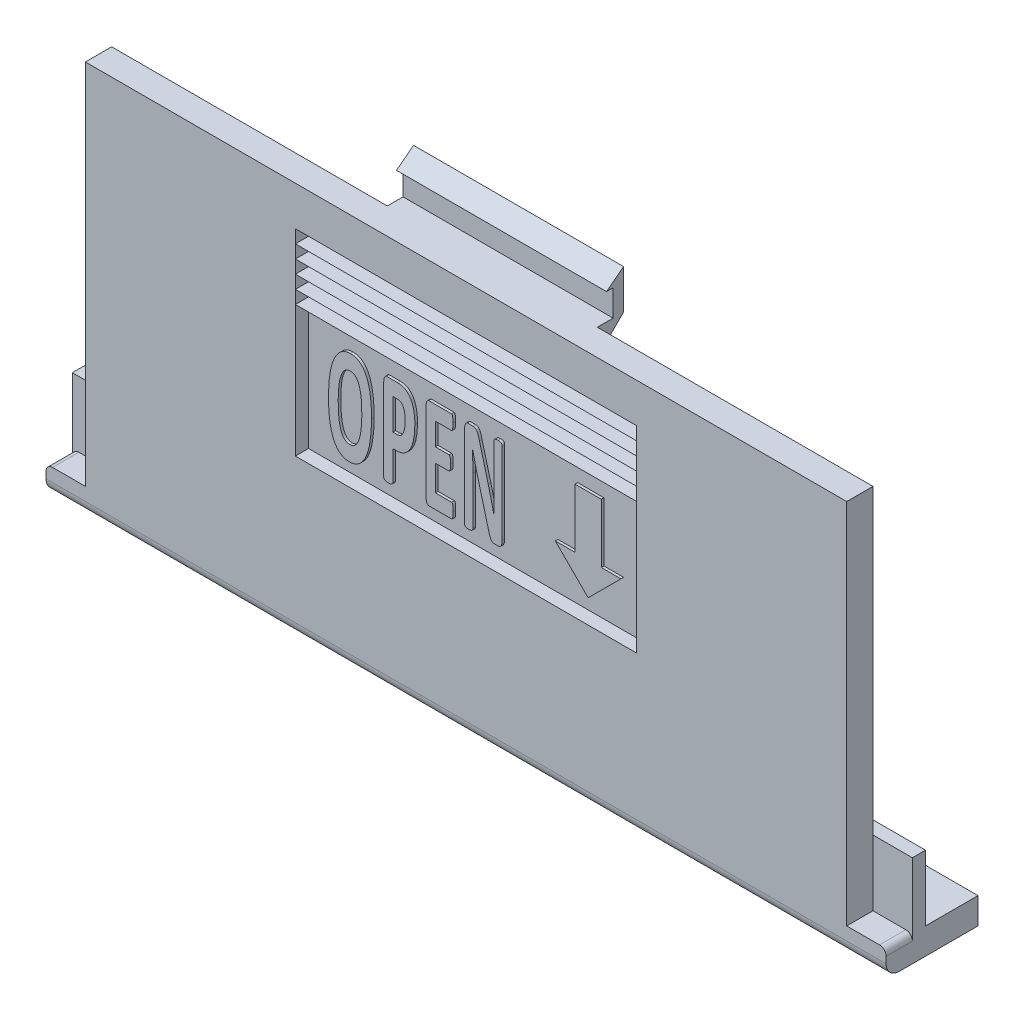
from build123d import *

# Parameters (mm, degrees)
SCHIZZO1_W                                         = 64
SCHIZZO1_H                                         = 30
ESTRUSIONE_FACCIA_SPORTELLO_DEPTH                  = 1
TAGLIO_ESTRUSIONE3_DEPTH                           = 2
TAGLIO_ESTRUSIONE3_DEPTH_BACK                      = 2
SCHIZZO3_W                                         = 3
SCHIZZO3_H                                         = 28
TAGLIO_ESTRUSIONE4_DEPTH                           = 2
TAGLIO_ESTRUSIONE4_DEPTH_BACK                      = 2
SCHIZZO4_W                                         = 3
SCHIZZO4_H                                         = 28
ESTRUSIONE_CHIUSURA_INFERIORE_SPORTELLO_DEPTH      = 32
ESTRUSIONE_CHIUSURA_INFERIORE_SPORTELLO_DEPTH_BACK = 32
SCHIZZO5_W                                         = 5
SCHIZZO5_H                                         = 2
SCHIZZO7_W                                         = 1
SCHIZZO7_H                                         = 5
ESTRUSIONE_ALETTA_SPORTELLO_INFERIORE_DEPTH        = 4
SCHIZZO24_W                                        = 1
SCHIZZO24_H                                        = 5
ESTRUSIONE_ESTRUSIONE12_DEPTH                      = 4
ESTRUSIONE_SUPPORTO_CHIUSURA_DEPTH                 = 8
ESTRUSIONE_SUPPORTO_CHIUSURA_DEPTH_BACK            = 8
ESTRUSIONE_GANCIO_CHIUSURA_DEPTH                   = 8
ESTRUSIONE_GANCIO_CHIUSURA_DEPTH_BACK              = 8
SCHIZZO10_W                                        = 26
SCHIZZO10_H                                        = 15
TAGLIO_SCAVO_SPORTELLO_DEPTH                       = 1
ESTRUSIONE_ESTRUSIONE7_DEPTH                       = 26
ESTRUSIONE_ESTRUSIONE8_DEPTH                       = 26
RIPETIZIONE_A_L3_COUNT                             = 5
RIPETIZIONE_A_L3_PITCH                             = 1
ESTRUSIONE_OPEN_DEPTH                              = 0.2
ESTRUSIONE_ESTRUSIONE11_DEPTH                      = 0.2
RACCORDO6_R                                        = 0.5
RACCORDO7_R                                        = 0.5
RACCORDO10_R                                       = 0.5
RACCORDO11_R                                       = 1


with BuildPart() as part:
    # Schizzo1 → Estrusione-Faccia sportello (new, symmetric)
    with BuildSketch(Plane.XY):
        Rectangle(SCHIZZO1_W, SCHIZZO1_H)
    extrude(amount=ESTRUSIONE_FACCIA_SPORTELLO_DEPTH, both=True)

    # Schizzo3 → Taglio-Estrusione3 (cut, two sides: drawn at the far end of the back side and taken through both)
    with BuildSketch(Plane.XY.offset(-TAGLIO_ESTRUSIONE3_DEPTH_BACK)):
        with Locations((-30.5, 1)):
            Rectangle(SCHIZZO3_W, SCHIZZO3_H)
    extrude(amount=TAGLIO_ESTRUSIONE3_DEPTH + TAGLIO_ESTRUSIONE3_DEPTH_BACK, mode=Mode.SUBTRACT)

    # Schizzo4 → Taglio-Estrusione4 (cut, two sides: drawn at the far end of the back side and taken through both)
    with BuildSketch(Plane.XY.offset(-TAGLIO_ESTRUSIONE4_DEPTH_BACK)):
        with Locations((30.5, 1)):
            Rectangle(SCHIZZO4_W, SCHIZZO4_H)
    extrude(amount=TAGLIO_ESTRUSIONE4_DEPTH + TAGLIO_ESTRUSIONE4_DEPTH_BACK, mode=Mode.SUBTRACT)

    # Schizzo5 → Estrusione-Chiusura inferiore sportello (add, two sides: drawn at the far end of the back side and taken through both)
    with BuildSketch(Plane(origin=(0, 0, 0), x_dir=(0, 0, -1), z_dir=(1, 0, 0)).offset(-ESTRUSIONE_CHIUSURA_INFERIORE_SPORTELLO_DEPTH_BACK)):
        with Locations((3.5, -14)):
            Rectangle(SCHIZZO5_W, SCHIZZO5_H)
    extrude(amount=ESTRUSIONE_CHIUSURA_INFERIORE_SPORTELLO_DEPTH + ESTRUSIONE_CHIUSURA_INFERIORE_SPORTELLO_DEPTH_BACK)

    # Schizzo7 → Estrusione-Aletta sportello inferiore (add)
    with BuildSketch(Plane(origin=(28, 0, 0), x_dir=(0, 0, -1), z_dir=(1, 0, 0))):
        with Locations((1.5, -10.5)):
            Rectangle(SCHIZZO7_W, SCHIZZO7_H)
    extrude(amount=ESTRUSIONE_ALETTA_SPORTELLO_INFERIORE_DEPTH)

    # Schizzo24 → Estrusione-Estrusione12 (add)
    with BuildSketch(Plane(origin=(-28, 0, 0), x_dir=(0, 0, -1), z_dir=(1, 0, 0))):
        with Locations((1.5, -10.5)):
            Rectangle(SCHIZZO24_W, SCHIZZO24_H)
    extrude(amount=-ESTRUSIONE_ESTRUSIONE12_DEPTH)

    # Schizzo8 → Estrusione-Supporto chiusura (add, two sides: drawn at the far end of the back side and taken through both)
    with BuildSketch(Plane(origin=(0, 0, 0), x_dir=(0, 0, -1), z_dir=(1, 0, 0)).offset(-ESTRUSIONE_SUPPORTO_CHIUSURA_DEPTH_BACK)):
        Polygon((1, 15), (1, 13), (3, 15), align=None)
    extrude(amount=ESTRUSIONE_SUPPORTO_CHIUSURA_DEPTH + ESTRUSIONE_SUPPORTO_CHIUSURA_DEPTH_BACK)

    # Schizzo9 → Estrusione-Gancio chiusura (add, two sides: drawn at the far end of the back side and taken through both)
    with BuildSketch(Plane(origin=(0, 0, 0), x_dir=(0, 0, -1), z_dir=(1, 0, 0)).offset(-ESTRUSIONE_GANCIO_CHIUSURA_DEPTH_BACK)):
        Polygon((2.2, 15), (3, 15), (3, 18), (1.7, 17), (2.2, 17), align=None)
    extrude(amount=ESTRUSIONE_GANCIO_CHIUSURA_DEPTH + ESTRUSIONE_GANCIO_CHIUSURA_DEPTH_BACK)

    # Schizzo10 → Taglio-Scavo sportello (cut)
    with BuildSketch(Plane.XY):
        with Locations((0, 4.5)):
            Rectangle(SCHIZZO10_W, SCHIZZO10_H)
    extrude(amount=TAGLIO_SCAVO_SPORTELLO_DEPTH, mode=Mode.SUBTRACT)

    # Schizzo13 → Estrusione-Estrusione7 (add)
    with BuildSketch(Plane(origin=(-13, 0, 0), x_dir=(0, 0, -1), z_dir=(1, 0, 0))):
        Polygon((-1, 12), (0, 12), (0, 11), align=None)
    extrude(amount=ESTRUSIONE_ESTRUSIONE7_DEPTH)

    # Schizzo14 → Estrusione-Estrusione8 (add)
    with BuildSketch(Plane(origin=(-13, 0, 0), x_dir=(0, 0, -1), z_dir=(1, 0, 0))):
        Polygon((0, 11), (-1, 11), (0, 10), align=None)
    estrusione_estrusione8 = extrude(amount=ESTRUSIONE_ESTRUSIONE8_DEPTH)

    # Ripetizione a L3: Estrusione-Estrusione8 ×5
    with Locations(*[(0, -i * RIPETIZIONE_A_L3_PITCH, 0) for i in range(1, RIPETIZIONE_A_L3_COUNT)]):
        add(estrusione_estrusione8)

    # Schizzo19 → Estrusione-Open (add)
    # profile 1 of 4: a face of its own
    with BuildSketch(Plane.XY):
        with BuildLine():
            add(Edge.make_bspline(
                [(-7.999001815, 1.547640653), (-7.999992613, 1.407864648), (-8.001922827, 1.135561377), (-8.02347731, 0.738327912), (-8.055698522, 0.363120068), (-8.102930933, 0.011211096), (-8.163693675, -0.316075285), (-8.232594657, -0.618932464), (-8.32159197, -0.894511465), (-8.418635135, -1.145794204), (-8.52813523, -1.37133144), (-8.65579916, -1.566108616), (-8.7906941, -1.737394737), (-8.943518747, -1.876132425), (-9.106352456, -1.988706108), (-9.284007177, -2.067346582), (-9.47393227, -2.114735066), (-9.604749937, -2.120790371), (-9.671188748, -2.123865699)],
                knots=[0, 0, 0, 0, 1.514222927, 2.949918723, 4.308734705, 5.593484874, 6.794834329, 7.914635642, 8.955730053, 9.929132873, 10.831941001, 11.665496277, 12.448323255, 13.187097232, 13.893345269, 14.583958704, 15.280830313, 16, 16, 16, 16], degree=3))
            add(Edge.make_bspline(
                [(-9.671188748, -2.123865699), (-9.736497229, -2.121621839), (-9.864678764, -2.117217797), (-10.050362157, -2.07678146), (-10.222541608, -2.008995036), (-10.382559825, -1.915861269), (-10.528088025, -1.793558917), (-10.658554689, -1.642387177), (-10.780476931, -1.467276556), (-10.88587459, -1.261540644), (-10.979716847, -1.028158346), (-11.059161104, -0.765229107), (-11.129285373, -0.473727146), (-11.185392261, -0.152250475), (-11.230012396, 0.199041335), (-11.25832403, 0.580698439), (-11.278328892, 0.992679032), (-11.280379769, 1.277649739), (-11.281442831, 1.425362976)],
                knots=[0, 0, 0, 0, 0.725663488, 1.424266175, 2.100994291, 2.776492084, 3.47449916, 4.204448662, 4.991582669, 5.842144597, 6.769215763, 7.785958339, 8.894031491, 10.101997046, 11.41348336, 12.83084749, 14.357284574, 16, 16, 16, 16], degree=3))
            add(Edge.make_bspline(
                [(-11.281442831, 1.425362976), (-11.280435752, 1.561962101), (-11.278471106, 1.82844432), (-11.257054606, 2.21775869), (-11.224277134, 2.585952409), (-11.179125694, 2.932741282), (-11.118932836, 3.256032745), (-11.046840262, 3.556093479), (-10.959526838, 3.830145005), (-10.861884469, 4.080037934), (-10.74991521, 4.302842819), (-10.623876783, 4.497950066), (-10.4870945, 4.667067404), (-10.33695757, 4.808171059), (-10.174187534, 4.922717022), (-9.994937408, 4.999747738), (-9.804702542, 5.050354333), (-9.673108034, 5.055921266), (-9.606079855, 5.058756806)],
                knots=[0, 0, 0, 0, 1.492209114, 2.911052286, 4.258207687, 5.530021065, 6.730058531, 7.849346097, 8.899158892, 9.869955582, 10.777748849, 11.618284525, 12.403184643, 13.147830977, 13.86324965, 14.564933045, 15.269043018, 16, 16, 16, 16], degree=3))
            add(Edge.make_bspline(
                [(-9.606079855, 5.058756806), (-9.542322301, 5.056594598), (-9.417210789, 5.052351695), (-9.235898557, 5.010594232), (-9.065250997, 4.946121407), (-8.908273092, 4.851470334), (-8.760796992, 4.733063762), (-8.629920165, 4.58236771), (-8.507826506, 4.406969427), (-8.403149333, 4.201238253), (-8.306797166, 3.969614529), (-8.226373126, 3.708561843), (-8.153856368, 3.420009369), (-8.098253206, 3.101941563), (-8.054664838, 2.755278014), (-8.020794566, 2.379274682), (-8.00252443, 1.973414949), (-8.000201929, 1.69269705), (-7.999001815, 1.547640653)],
                knots=[0, 0, 0, 0, 0.715505355, 1.404036879, 2.080196936, 2.757690514, 3.455489848, 4.197083904, 4.992517363, 5.852047519, 6.785638831, 7.809201734, 8.918813181, 10.127803088, 11.435413021, 12.845004552, 14.369707549, 16, 16, 16, 16], degree=3))
        make_face()
        with BuildLine():
            add(Edge.make_bspline(
                [(-8.739019964, 1.47300363), (-8.739715991, 1.561939183), (-8.741079318, 1.736139689), (-8.749177903, 1.990804749), (-8.761379236, 2.233368915), (-8.780101375, 2.462740465), (-8.805566146, 2.678284835), (-8.835560604, 2.878624956), (-8.878183814, 3.062114647), (-8.924364216, 3.230298947), (-8.979511911, 3.381435077), (-9.04283932, 3.51506699), (-9.115727702, 3.629936206), (-9.197103926, 3.727189193), (-9.288695936, 3.805344754), (-9.391891551, 3.862645811), (-9.507869481, 3.894738114), (-9.588419889, 3.89893018), (-9.629900181, 3.901088929)],
                knots=[0, 0, 0, 0, 1.513210283, 2.963966486, 4.334859306, 5.64527595, 6.878616546, 8.02765105, 9.0895477, 10.081742653, 10.993587949, 11.823414824, 12.592936149, 13.302171044, 13.973326409, 14.630312022, 15.29466455, 16, 16, 16, 16], degree=3))
            add(Edge.make_bspline(
                [(-9.629900181, 3.901088929), (-9.672050448, 3.898797281), (-9.75381806, 3.894351697), (-9.870405287, 3.854925504), (-9.977388869, 3.794810512), (-10.069543308, 3.705632097), (-10.151212048, 3.598377668), (-10.226014409, 3.475271445), (-10.292783496, 3.335876648), (-10.350982388, 3.180675099), (-10.399735025, 3.009993708), (-10.440232635, 2.82524384), (-10.475906742, 2.627309181), (-10.508492002, 2.340767163), (-10.534966407, 1.962070464), (-10.539234389, 1.653560654), (-10.541424682, 1.495235935)],
                knots=[0, 0, 0, 0, 0.631705943, 1.22545101, 1.831330726, 2.461783034, 3.136509036, 3.854189724, 4.622759054, 5.456123766, 6.342377968, 7.288123355, 8.297856721, 9.363579254, 11.62062667, 14, 14, 14, 14], degree=3))
            add(Edge.make_bspline(
                [(-10.541424682, 1.495235935), (-10.540731288, 1.403124465), (-10.539376123, 1.223102489), (-10.531290135, 0.960498546), (-10.519104999, 0.711580853), (-10.500458386, 0.477974756), (-10.475075033, 0.259741332), (-10.444086978, 0.057623634), (-10.404504155, -0.128522609), (-10.357828672, -0.298120385), (-10.302446627, -0.449664338), (-10.239654027, -0.583131159), (-10.166125254, -0.696537896), (-10.08530411, -0.792962328), (-9.991689427, -0.867117503), (-9.887364705, -0.921239834), (-9.771524822, -0.953459992), (-9.690446074, -0.957684149), (-9.648956443, -0.959845735)],
                knots=[0, 0, 0, 0, 1.549283116, 3.027907476, 4.418653304, 5.740671561, 6.968719117, 8.113378157, 9.178583556, 10.167976361, 11.069370615, 11.889686496, 12.642900457, 13.337246653, 13.996334239, 14.637436389, 15.302748696, 16, 16, 16, 16], degree=3))
            add(Edge.make_bspline(
                [(-9.648956443, -0.959845735), (-9.607435191, -0.957237113), (-9.526046492, -0.952123772), (-9.408782872, -0.916579481), (-9.303411498, -0.85437442), (-9.210898988, -0.767823769), (-9.128326854, -0.661413552), (-9.054665909, -0.537038183), (-8.987310558, -0.396533921), (-8.931109756, -0.2386141), (-8.883035107, -0.065818024), (-8.839162914, 0.120351897), (-8.806707434, 0.321030209), (-8.773300074, 0.611574333), (-8.744987978, 0.99712443), (-8.741045409, 1.311498123), (-8.739019964, 1.47300363)],
                knots=[0, 0, 0, 0, 0.617943297, 1.211273719, 1.804656479, 2.423854892, 3.08604707, 3.803738118, 4.572206993, 5.402410358, 6.29550612, 7.241817814, 8.24852195, 9.319904157, 11.595659979, 14, 14, 14, 14], degree=3))
        make_face(mode=Mode.SUBTRACT)
    # profile 2 of 4: a face of its own
    with BuildSketch(Plane.XY):
        with BuildLine():
            add(Edge.make_bspline(
                [(-4.698774955, 2.829174229), (-4.700285103, 2.734412606), (-4.703214751, 2.550577519), (-4.717483429, 2.282675488), (-4.748900247, 2.032258885), (-4.787256682, 1.798136432), (-4.8385343, 1.581948118), (-4.897606687, 1.382839089), (-4.969727834, 1.201804533), (-5.051475517, 1.038243558), (-5.14416084, 0.892499389), (-5.245525547, 0.76435089), (-5.358091691, 0.654869827), (-5.480300812, 0.563431327), (-5.61440064, 0.49272634), (-5.759116024, 0.44122562), (-5.915510757, 0.410741935), (-6.023579698, 0.407505635), (-6.07876588, 0.405852995)],
                knots=[0, 0, 0, 0, 1.461455278, 2.835185284, 4.134154379, 5.351272959, 6.491690788, 7.558110418, 8.550922145, 9.492729457, 10.373562986, 11.209812739, 12.006400785, 12.788385237, 13.55518408, 14.334864683, 15.149686676, 16, 16, 16, 16], degree=3))
            Line((-6.07876588, 0.405852995), (-6.367785844, 0.405852995))
            Line((-6.367785844, 0.405852995), (-6.367785844, -1.806261343))
            add(Edge.make_bspline(
                [(-6.367785844, -1.806261343), (-6.368844012, -1.82324251), (-6.370892622, -1.856117987), (-6.382540696, -1.903255198), (-6.408001013, -1.943157774), (-6.443970375, -1.975898458), (-6.493160874, -1.999523504), (-6.5544066, -2.018964225), (-6.632703419, -2.028828485), (-6.690138117, -2.03071609), (-6.721914701, -2.031760436)],
                knots=[0, 0, 0, 0, 0.853264808, 1.651917505, 2.403280724, 3.192612898, 4.059399671, 5.117334518, 6.405123297, 8, 8, 8, 8], degree=3))
            add(Edge.make_bspline(
                [(-6.721914701, -2.031760436), (-6.753159514, -2.030705942), (-6.810059572, -2.028785599), (-6.88835242, -2.018815402), (-6.950449924, -1.999287401), (-7.00104698, -1.976820223), (-7.035911448, -1.942976023), (-7.059838068, -1.903049559), (-7.069324477, -1.855894935), (-7.071657546, -1.823211508), (-7.072867514, -1.806261343)],
                knots=[0, 0, 0, 0, 1.571764181, 2.862346282, 3.947976174, 4.840358449, 5.611923721, 6.351160088, 7.144884389, 8, 8, 8, 8], degree=3))
            Line((-7.072867514, -1.806261343), (-7.072867514, 4.431488203))
            add(Edge.make_bspline(
                [(-7.072867514, 4.431488203), (-7.071775488, 4.471207995), (-7.069746792, 4.544996897), (-7.05967921, 4.648412289), (-7.03978617, 4.735631548), (-7.011220757, 4.807799866), (-6.975375376, 4.863459218), (-6.934046325, 4.904424068), (-6.886513646, 4.93039701), (-6.851901011, 4.933397094), (-6.834664247, 4.934891107)],
                knots=[0, 0, 0, 0, 1.559401259, 2.896956497, 4.071088472, 5.058739861, 5.928830014, 6.648810893, 7.327120646, 8, 8, 8, 8], degree=3))
            Line((-6.834664247, 4.934891107), (-6.016833031, 4.934891107))
            add(Edge.make_bspline(
                [(-6.016833031, 4.934891107), (-5.977093228, 4.933987683), (-5.898937042, 4.932210919), (-5.779101707, 4.917219096), (-5.651013914, 4.887377044), (-5.535550033, 4.847170497), (-5.436251129, 4.798365609), (-5.355451122, 4.749916719), (-5.279058971, 4.682409043), (-5.198932599, 4.607182462), (-5.122314438, 4.518963822), (-5.049730417, 4.419591267), (-4.985216603, 4.307977529), (-4.926630505, 4.185718067), (-4.874688385, 4.052729896), (-4.825699709, 3.910362812), (-4.789585251, 3.755083846), (-4.755140895, 3.590724158), (-4.730677251, 3.415047968), (-4.711260059, 3.229193206), (-4.700197166, 3.03257661), (-4.699256204, 2.898001658), (-4.698774955, 2.829174229)],
                knots=[0, 0, 0, 0, 0.852686986, 1.676977687, 2.586351544, 3.671461758, 4.291288958, 4.959605195, 5.685406448, 6.472783426, 7.31809823, 8.188386777, 9.109954294, 10.080426591, 11.095104556, 12.172815933, 13.307971146, 14.513263901, 15.776022001, 17.112123348, 18.523015441, 20, 20, 20, 20], degree=3))
        make_face()
        with BuildLine():
            add(Edge.make_bspline(
                [(-5.43561706, 2.727540835), (-5.436780011, 2.785250162), (-5.439012096, 2.89601329), (-5.448920009, 3.054201863), (-5.469378826, 3.196502872), (-5.498567487, 3.32242943), (-5.530932714, 3.433736276), (-5.569103291, 3.529212913), (-5.609673923, 3.609745936), (-5.667253125, 3.691411643), (-5.74350959, 3.770079979), (-5.8518187, 3.820689634), (-5.959811237, 3.841775007), (-6.031577464, 3.845316239), (-6.067649728, 3.847096189)],
                knots=[0, 0, 0, 0, 1.432622446, 2.749672398, 3.931393755, 4.995924452, 5.956103252, 6.805129406, 7.5455544, 8.187050395, 9.28345337, 10.217755417, 11.104180324, 12, 12, 12, 12], degree=3))
            Line((-6.067649728, 3.847096189), (-6.367785844, 3.847096189))
            Line((-6.367785844, 3.847096189), (-6.367785844, 1.495235935))
            Line((-6.367785844, 1.495235935), (-6.05176951, 1.495235935))
            add(Edge.make_bspline(
                [(-6.05176951, 1.495235935), (-6.024718581, 1.496692657), (-5.972258376, 1.499517696), (-5.896534569, 1.514530983), (-5.828526688, 1.544180165), (-5.745984017, 1.598629602), (-5.657690292, 1.69630845), (-5.575115888, 1.844989821), (-5.513549249, 2.026605145), (-5.469176504, 2.237744223), (-5.440493772, 2.474804994), (-5.437283617, 2.641171449), (-5.43561706, 2.727540835)],
                knots=[0, 0, 0, 0, 0.532783982, 1.033234639, 1.509133368, 1.982861901, 2.970124091, 4.061688404, 5.31011373, 6.727822439, 8.30124429, 10, 10, 10, 10], degree=3))
        make_face(mode=Mode.SUBTRACT)
    # profile 3 of 4: a face of its own
    with BuildSketch(Plane.XY):
        with BuildLine():
            add(Edge.make_bspline(
                [(-1.786025408, -1.447368421), (-1.786228994, -1.495021144), (-1.786600098, -1.581884759), (-1.791546267, -1.70046054), (-1.797900373, -1.796742495), (-1.8114151, -1.871718405), (-1.823936076, -1.929310527), (-1.842262221, -1.96831778), (-1.864460815, -1.99392746), (-1.882495905, -1.998079984), (-1.890834846, -2)],
                knots=[0, 0, 0, 0, 1.950716643, 3.555857648, 4.860762598, 5.894058225, 6.677301116, 7.258856554, 7.657315171, 8, 8, 8, 8], degree=3))
            Line((-1.890834846, -2), (-3.631306715, -2))
            add(Edge.make_bspline(
                [(-3.631306715, -2), (-3.645939457, -1.999014624), (-3.675204941, -1.997043873), (-3.714442309, -1.972804512), (-3.752452397, -1.941195861), (-3.783480108, -1.89282282), (-3.811959345, -1.831483266), (-3.826079745, -1.752637283), (-3.840837723, -1.659646336), (-3.84089474, -1.591971099), (-3.84092559, -1.555353902)],
                knots=[0, 0, 0, 0, 0.642750387, 1.285500773, 2.003248899, 2.832813289, 3.813123422, 4.995720363, 6.374467478, 8, 8, 8, 8], degree=3))
            Line((-3.84092559, -1.555353902), (-3.84092559, 4.490245009))
            add(Edge.make_bspline(
                [(-3.84092559, 4.490245009), (-3.840835536, 4.526850516), (-3.840667808, 4.59502955), (-3.826494162, 4.688156491), (-3.811605374, 4.766763118), (-3.783649696, 4.827910869), (-3.75180443, 4.875811514), (-3.715447891, 4.909731633), (-3.674693101, 4.931497994), (-3.645850881, 4.933753653), (-3.631306715, 4.934891107)],
                knots=[0, 0, 0, 0, 1.62448532, 3.025660573, 4.184545222, 5.164223818, 5.993253785, 6.726196792, 7.357663686, 8, 8, 8, 8], degree=3))
            Line((-3.631306715, 4.934891107), (-1.900362976, 4.934891107))
            add(Edge.make_bspline(
                [(-1.900362976, 4.934891107), (-1.892587027, 4.93348561), (-1.874992607, 4.930305431), (-1.853731755, 4.905269493), (-1.836546761, 4.866149291), (-1.823748617, 4.808321031), (-1.812974804, 4.73194878), (-1.805976203, 4.635352561), (-1.79863354, 4.515231756), (-1.798695243, 4.426743024), (-1.798729583, 4.377495463)],
                knots=[0, 0, 0, 0, 0.313648153, 0.709682774, 1.258883979, 2.058242803, 3.10316936, 4.400136009, 5.996529938, 8, 8, 8, 8], degree=3))
            add(Edge.make_bspline(
                [(-1.798729583, 4.377495463), (-1.7987408, 4.331426786), (-1.798761442, 4.246647355), (-1.8060334, 4.130212712), (-1.812951345, 4.03472434), (-1.823469962, 3.959215103), (-1.837323062, 3.902474929), (-1.853203111, 3.862530561), (-1.875296958, 3.837787468), (-1.892618649, 3.833246283), (-1.900362976, 3.831215971)],
                knots=[0, 0, 0, 0, 1.914150093, 3.522579126, 4.847170903, 5.892589009, 6.687648521, 7.268472367, 7.672942445, 8, 8, 8, 8], degree=3))
            Line((-1.900362976, 3.831215971), (-3.139019964, 3.831215971))
            Line((-3.139019964, 3.831215971), (-3.139019964, 2.138384755))
            Line((-3.139019964, 2.138384755), (-2.09092559, 2.138384755))
            add(Edge.make_bspline(
                [(-2.09092559, 2.138384755), (-2.083113567, 2.136406658), (-2.065262004, 2.131886431), (-2.044560919, 2.105048473), (-2.025696111, 2.066725869), (-2.013233863, 2.010587605), (-1.999295002, 1.937837726), (-1.99371901, 1.843548836), (-1.986037824, 1.727742874), (-1.986088575, 1.642946961), (-1.986116152, 1.596869328)],
                knots=[0, 0, 0, 0, 0.329435408, 0.752805886, 1.347427083, 2.126824548, 3.139670411, 4.451810168, 6.071933191, 8, 8, 8, 8], degree=3))
            add(Edge.make_bspline(
                [(-1.986116152, 1.596869328), (-1.986077473, 1.549733213), (-1.986007022, 1.463879338), (-1.993594571, 1.347531049), (-1.999468161, 1.253804034), (-2.013001287, 1.182044969), (-2.025690574, 1.126943844), (-2.044437229, 1.090086459), (-2.065505739, 1.06467849), (-2.083134475, 1.061515755), (-2.09092559, 1.060117967)],
                knots=[0, 0, 0, 0, 1.982703376, 3.611302444, 4.90811173, 5.926256529, 6.688218432, 7.266111998, 7.675654216, 8, 8, 8, 8], degree=3))
            Line((-2.09092559, 1.060117967), (-3.139019964, 1.060117967))
            Line((-3.139019964, 1.060117967), (-3.139019964, -0.896324864))
            Line((-3.139019964, -0.896324864), (-1.890834846, -0.896324864))
            add(Edge.make_bspline(
                [(-1.890834846, -0.896324864), (-1.882439371, -0.898196331), (-1.863899604, -0.9023291), (-1.84289379, -0.929695284), (-1.823728586, -0.968413401), (-1.811668868, -1.025767269), (-1.797685166, -1.100050185), (-1.791660091, -1.195355816), (-1.786541185, -1.313373107), (-1.786208845, -1.399712861), (-1.786025408, -1.447368421)],
                knots=[0, 0, 0, 0, 0.343862803, 0.759353808, 1.342908335, 2.128843612, 3.1442583, 4.453648842, 6.042577796, 8, 8, 8, 8], degree=3))
        make_face()
    # profile 4 of 4: a face of its own
    with BuildSketch(Plane.XY):
        with BuildLine():
            add(Edge.make_bspline(
                [(1.946143376, -1.506125227), (1.945778622, -1.545414705), (1.945089187, -1.619677178), (1.925573653, -1.722902467), (1.90400313, -1.812943018), (1.870599506, -1.886379558), (1.831150438, -1.944191958), (1.784368988, -1.98388512), (1.732423595, -2.005748564), (1.697002917, -2.009331214), (1.679355717, -2.011116152)],
                knots=[0, 0, 0, 0, 1.495525268, 2.826746697, 3.997430731, 5.018536672, 5.88707963, 6.64721399, 7.326018409, 8, 8, 8, 8], degree=3))
            Line((1.679355717, -2.011116152), (1.379219601, -2.011116152))
            add(Edge.make_bspline(
                [(1.379219601, -2.011116152), (1.349886015, -2.009458449), (1.29386842, -2.006292775), (1.213228824, -1.976545418), (1.145320265, -1.916990308), (1.084049794, -1.830685415), (1.030725492, -1.711057645), (0.985822654, -1.59119826), (0.952418261, -1.474401971), (0.921973182, -1.37155625), (0.89212611, -1.255239986), (0.871075157, -1.174221401), (0.859936479, -1.131352087)],
                knots=[0, 0, 0, 0, 0.799713038, 1.527191445, 2.297087651, 3.228028069, 4.398216312, 5.861621009, 6.721389304, 7.714129142, 8.790478577, 10, 10, 10, 10], degree=3))
            Line((0.859936479, -1.131352087), (-0.002359347, 2.111388385))
            add(Edge.make_bspline(
                [(-0.002359347, 2.111388385), (-0.028010025, 2.21137291), (-0.081258504, 2.418931702), (-0.157747247, 2.73691821), (-0.229868679, 3.0619677), (-0.273231314, 3.279564379), (-0.294555354, 3.386569873)],
                knots=[0, 0, 0, 0, 0.946662825, 1.965186038, 2.999358472, 4, 4, 4, 4], degree=3))
            Line((-0.294555354, 3.386569873), (-0.300907441, 3.386569873))
            add(Edge.make_bspline(
                [(-0.300907441, 3.386569873), (-0.297470342, 3.2579455), (-0.290610863, 3.001247609), (-0.284981541, 2.614799558), (-0.279422653, 2.223623944), (-0.278926632, 1.960528554), (-0.278675136, 1.827132486)],
                knots=[0, 0, 0, 0, 0.989989876, 1.975739947, 2.973648566, 4, 4, 4, 4], degree=3))
            Line((-0.278675136, 1.827132486), (-0.278675136, -1.801497278))
            add(Edge.make_bspline(
                [(-0.278675136, -1.801497278), (-0.278920685, -1.818560964), (-0.279396626, -1.851634991), (-0.293338917, -1.897433407), (-0.31152862, -1.940198855), (-0.344932392, -1.973485847), (-0.388886882, -2.000148026), (-0.445774476, -2.018627297), (-0.518095719, -2.029006516), (-0.571360558, -2.030774942), (-0.601043557, -2.031760436)],
                knots=[0, 0, 0, 0, 0.893605656, 1.732048845, 2.504929649, 3.313182694, 4.164041127, 5.195260529, 6.436997487, 8, 8, 8, 8], degree=3))
            add(Edge.make_bspline(
                [(-0.601043557, -2.031760436), (-0.629648333, -2.030692317), (-0.681817481, -2.028744292), (-0.752778722, -2.018999863), (-0.8086856, -1.999654612), (-0.852521019, -1.974052029), (-0.883817111, -1.939540433), (-0.903368388, -1.897977937), (-0.912047093, -1.851098681), (-0.913255605, -1.818462904), (-0.913883848, -1.801497278)],
                knots=[0, 0, 0, 0, 1.529137315, 2.788827678, 3.808252555, 4.671412955, 5.472114627, 6.256169975, 7.093474326, 8, 8, 8, 8], degree=3))
            Line((-0.913883848, -1.801497278), (-0.913883848, 4.431488203))
            add(Edge.make_bspline(
                [(-0.913883848, 4.431488203), (-0.913203083, 4.471259969), (-0.911936151, 4.545276855), (-0.896897743, 4.648325025), (-0.876669131, 4.736202372), (-0.844183501, 4.808061039), (-0.805349151, 4.863902859), (-0.760818603, 4.904098755), (-0.712097697, 4.930209246), (-0.677028416, 4.933348784), (-0.659800363, 4.934891107)],
                knots=[0, 0, 0, 0, 1.540318101, 2.866595091, 4.031250264, 5.023082951, 5.905731602, 6.647054225, 7.335355, 8, 8, 8, 8], degree=3))
            Line((-0.659800363, 4.934891107), (-0.28185118, 4.934891107))
            add(Edge.make_bspline(
                [(-0.28185118, 4.934891107), (-0.250353082, 4.93394971), (-0.191264805, 4.932183714), (-0.109139847, 4.903330193), (-0.038132113, 4.855166078), (0.018994405, 4.779754584), (0.074490723, 4.682185812), (0.120727962, 4.552910608), (0.170727968, 4.394087418), (0.200505592, 4.276588353), (0.216787659, 4.212341198)],
                knots=[0, 0, 0, 0, 0.786045474, 1.474567527, 2.152124126, 2.906829412, 3.822338454, 4.961302788, 6.338474867, 8, 8, 8, 8], degree=3))
            Line((0.216787659, 4.212341198), (0.891696915, 1.676270417))
            add(Edge.make_bspline(
                [(0.891696915, 1.676270417), (0.911332546, 1.60005816), (0.950187223, 1.449250548), (1.007256573, 1.224120112), (1.065185285, 1.001595231), (1.120242133, 0.779666938), (1.17453812, 0.560185816), (1.224612696, 0.342728123), (1.27681071, 0.128379332), (1.308046285, -0.014906562), (1.323638838, -0.086433757)],
                knots=[0, 0, 0, 0, 1.040694686, 2.059310221, 3.071145126, 4.081259572, 5.08289861, 6.060851611, 7.031992329, 8, 8, 8, 8], degree=3))
            Line((1.323638838, -0.086433757), (1.326814882, -0.086433757))
            add(Edge.make_bspline(
                [(1.326814882, -0.086433757), (1.324782857, 0.041138034), (1.320634512, 0.301573621), (1.312758878, 0.694843834), (1.312887261, 1.087117665), (1.311574816, 1.346492283), (1.310934664, 1.47300363)],
                knots=[0, 0, 0, 0, 0.981736137, 2.004197218, 3.026536603, 4, 4, 4, 4], degree=3))
            Line((1.310934664, 1.47300363), (1.310934664, 4.726860254))
            add(Edge.make_bspline(
                [(1.310934664, 4.726860254), (1.312032492, 4.743851107), (1.314116159, 4.776099605), (1.324906955, 4.822423471), (1.346251145, 4.863711139), (1.379261549, 4.899591162), (1.424199252, 4.928767878), (1.483179162, 4.944853223), (1.554481697, 4.956448092), (1.607293622, 4.956883044), (1.636479129, 4.957123412)],
                knots=[0, 0, 0, 0, 0.891312224, 1.691703235, 2.473133007, 3.297661816, 4.220763582, 5.238188177, 6.473737132, 8, 8, 8, 8], degree=3))
            add(Edge.make_bspline(
                [(1.636479129, 4.957123412), (1.664636735, 4.956917727), (1.715923454, 4.95654309), (1.78527935, 4.94431243), (1.843400415, 4.930129763), (1.884402238, 4.89835462), (1.916311665, 4.864138938), (1.932884226, 4.821541571), (1.94517543, 4.776292594), (1.945809621, 4.743904872), (1.946143376, 4.726860254)],
                knots=[0, 0, 0, 0, 1.50780539, 2.746341091, 3.789337842, 4.665114834, 5.491511926, 6.267991149, 7.08849935, 8, 8, 8, 8], degree=3))
            Line((1.946143376, 4.726860254), (1.946143376, -1.506125227))
        make_face()
    extrude(amount=ESTRUSIONE_OPEN_DEPTH)

    # Schizzo22 → Estrusione-Estrusione11 (add)
    with BuildSketch(Plane.XY):
        Polygon((8.5, -2), (11, 0.5), (9.5, 0.5), (9.5, 5), (8.5, 5), (7.5, 5), (7.5, 0.5), (6, 0.5), align=None)
    extrude(amount=ESTRUSIONE_ESTRUSIONE11_DEPTH)

    # Raccordo6
    raccordo6_edges = [part.edges().sort_by_distance(p)[0] for p in [
        (-32, -13, 0),
    ]]
    fillet(raccordo6_edges, radius=RACCORDO6_R)

    # Raccordo7
    raccordo7_edges = [part.edges().sort_by_distance(p)[0] for p in [
        (32, -13, 0),
    ]]
    fillet(raccordo7_edges, radius=RACCORDO7_R)

    # Raccordo10
    raccordo10_edges = [part.edges().sort_by_distance(p)[0] for p in [
        (0, 13, -1),
    ]]
    fillet(raccordo10_edges, radius=RACCORDO10_R)

    # Raccordo11
    raccordo11_edges = [part.edges().sort_by_distance(p)[0] for p in [
        (0, -15, 1),
    ]]
    fillet(raccordo11_edges, radius=RACCORDO11_R)


solid = part.part
